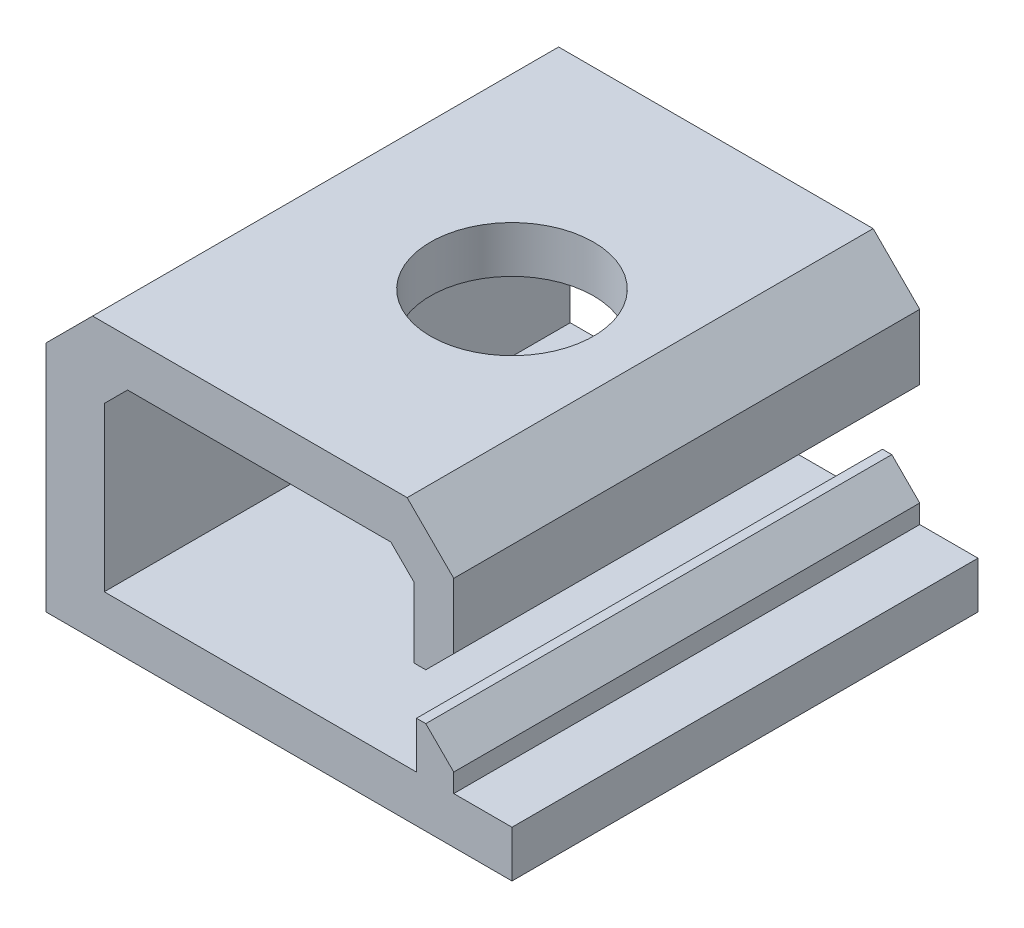
from build123d import *

# Parameters (mm, degrees)
SKETCH1_W           = 20
SKETCH1_H           = 20
SKETCH1_R           = 1.75
BOSS_EXTRUDE1_DEPTH = 2
SKETCH2_W           = 2.5
SKETCH2_H           = 20
BOSS_EXTRUDE2_DEPTH = 10
SKETCH3_W           = 20
SKETCH3_H           = 2
BOSS_EXTRUDE3_DEPTH = 15
SKETCH4_W           = 1.7
SKETCH4_H           = 20
BOSS_EXTRUDE4_DEPTH = 4
CHAMFER1_SIZE       = 1.2
CHAMFER2_SIZE       = 2
CHAMFER3_SIZE       = 1
SKETCH5_R           = 1.75
CUT_EXTRUDE1_DEPTH  = 34
SKETCH6_R           = 3.5
CUT_EXTRUDE2_DEPTH  = 2
SKETCH7_W           = 1.6
SKETCH7_H           = 20
BOSS_EXTRUDE5_DEPTH = 2
CHAMFER4_SIZE       = 1.2


with BuildPart() as part:
    # Sketch1 → Boss-Extrude1 (new body)
    with BuildSketch(Plane(origin=(0, 0, 0), x_dir=(1, 0, 0), z_dir=(0, 1, 0))):
        Rectangle(SKETCH1_W, SKETCH1_H)
        with Locations(Location((0, 0, 0), (0, 0, 270))):
            Circle(SKETCH1_R, mode=Mode.SUBTRACT)
    extrude(amount=BOSS_EXTRUDE1_DEPTH)

    # Sketch2 → Boss-Extrude2 (add)
    with BuildSketch(Plane(origin=(0, 2, 0), x_dir=(1, 0, 0), z_dir=(0, 1, 0))):
        with Locations((-8.75, 0)):
            Rectangle(SKETCH2_W, SKETCH2_H)
    extrude(amount=BOSS_EXTRUDE2_DEPTH)

    # Sketch3 → Boss-Extrude3 (add)
    with BuildSketch(Plane(origin=(-7.5, 0, 0), x_dir=(0, 0, -1), z_dir=(1, 0, 0))):
        with Locations((0, 11)):
            Rectangle(SKETCH3_W, SKETCH3_H)
    extrude(amount=BOSS_EXTRUDE3_DEPTH)

    # Sketch4 → Boss-Extrude4 (add)
    with BuildSketch(Plane.XZ.offset(-10)):
        with Locations((6.65, 0)):
            Rectangle(SKETCH4_W, SKETCH4_H)
    extrude(amount=BOSS_EXTRUDE4_DEPTH)

    # Chamfer1
    chamfer1_edges = [part.edges().sort_by_distance(p)[0] for p in [
        (7.5, 6, 0),
    ]]
    chamfer(chamfer1_edges, length=CHAMFER1_SIZE)

    # Chamfer2
    chamfer2_edges = [part.edges().sort_by_distance(p)[0] for p in [
        (-10, 12, 0),
        (7.5, 12, 0),
    ]]
    chamfer(chamfer2_edges, length=CHAMFER2_SIZE)

    # Chamfer3
    chamfer3_edges = [part.edges().sort_by_distance(p)[0] for p in [
        (-7.5, 10, 0),
        (5.8, 10, 0),
    ]]
    chamfer(chamfer3_edges, length=CHAMFER3_SIZE)

    # Sketch5 → Cut-Extrude1 (cut)
    with BuildSketch(Plane.XZ):
        with Locations(Location((0, 0, 0), (0, 0, 90))):
            Circle(SKETCH5_R)
    extrude(amount=-CUT_EXTRUDE1_DEPTH, mode=Mode.SUBTRACT)

    # Sketch6 → Cut-Extrude2 (cut)
    with BuildSketch(Plane(origin=(0, 12, 0), x_dir=(1, 0, 0), z_dir=(0, 1, 0))):
        with Locations(Location((0, 0, 0), (0, 0, 270))):
            Circle(SKETCH6_R)
    extrude(amount=-CUT_EXTRUDE2_DEPTH, mode=Mode.SUBTRACT)

    # Sketch7 → Boss-Extrude5 (add)
    with BuildSketch(Plane(origin=(0, 2, 0), x_dir=(1, 0, 0), z_dir=(0, 1, 0))):
        with Locations((6.7, 0)):
            Rectangle(SKETCH7_W, SKETCH7_H)
    extrude(amount=BOSS_EXTRUDE5_DEPTH)

    # Chamfer4
    chamfer4_edges = [part.edges().sort_by_distance(p)[0] for p in [
        (7.5, 4, 0),
    ]]
    chamfer(chamfer4_edges, length=CHAMFER4_SIZE)


solid = part.part
